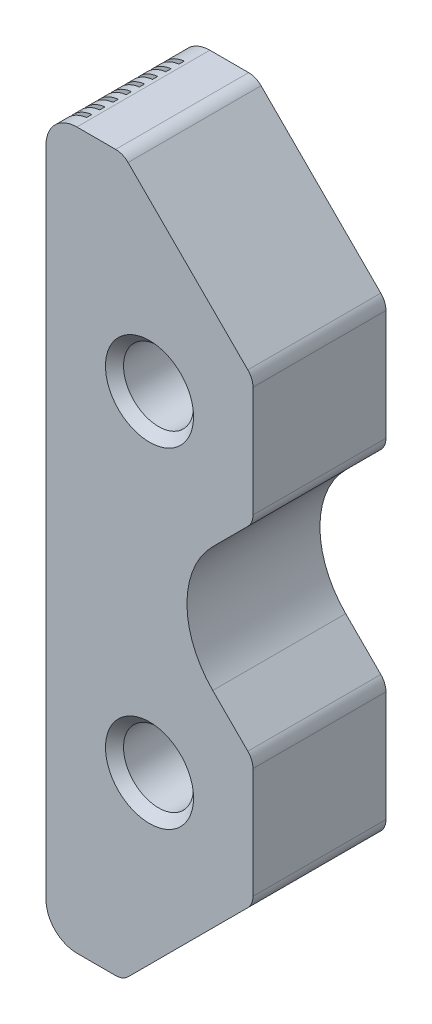
from build123d import *

# Parameters (mm, degrees)
BOSS_EXTRUDE1_DEPTH             = 7.6708
SKETCH2_W                       = 5.08
SKETCH2_H                       = 0.3048
CUT_EXTRUDE1_DEPTH              = 38.1
LPATTERN1_COUNT                 = 8
LPATTERN1_PITCH                 = 0.762
F_10_32_TAPPED_HOLE1_AT_2_COUNT = 2
F_10_32_TAPPED_HOLE1_AT_2_PITCH = 19.05


with BuildPart() as part:
    # Sketch1 → Boss-Extrude1 (new body)
    with BuildSketch(Plane.XY):
        with BuildLine():
            Line((52.1716, 20.6375), (54.409054124, 20.6375))
            ThreePointArc((54.409054124, 20.6375), (54.797860491, 20.560161605), (55.127474613, 20.33992049))
            Line((55.127474613, 20.33992049), (62.03402049, 13.433374613))
            ThreePointArc((62.03402049, 13.433374613), (62.254261605, 13.103760491), (62.3316, 12.714954124))
            Line((62.3316, 12.714954124), (62.3316, 6.335045876))
            ThreePointArc((62.3316, 6.335045876), (62.254261605, 5.946239509), (62.03402049, 5.616625387))
            Line((62.03402049, 5.616625387), (60.009497552, 3.592102448))
            ThreePointArc((60.009497552, 3.592102448), (58.5216, 0), (60.009497552, -3.592102448))
            Line((60.009497552, -3.592102448), (62.03402049, -5.616625387))
            ThreePointArc((62.03402049, -5.616625387), (62.254261605, -5.946239509), (62.3316, -6.335045876))
            Line((62.3316, -6.335045876), (62.3316, -12.714954124))
            ThreePointArc((62.3316, -12.714954124), (62.254261605, -13.103760491), (62.03402049, -13.433374613))
            Line((62.03402049, -13.433374613), (55.127474613, -20.33992049))
            ThreePointArc((55.127474613, -20.33992049), (54.797860491, -20.560161605), (54.409054124, -20.6375))
            Line((54.409054124, -20.6375), (52.1716, -20.6375))
            ThreePointArc((52.1716, -20.6375), (50.914364143, -20.116735857), (50.3936, -18.8595))
            Line((50.3936, -18.8595), (50.3936, 18.8595))
            ThreePointArc((50.3936, 18.8595), (50.914364143, 20.116735857), (52.1716, 20.6375))
        make_face()
    extrude(amount=-BOSS_EXTRUDE1_DEPTH)

    # Sketch2 → Cut-Extrude1 (cut, symmetric)
    with BuildSketch(Plane(origin=(0, 0, 0), x_dir=(1, 0, 0), z_dir=(0, 1, 0))):
        with Locations((49.4284, 0.9144)):
            Rectangle(SKETCH2_W, SKETCH2_H)
    cut_extrude1 = extrude(amount=CUT_EXTRUDE1_DEPTH, both=True, mode=Mode.SUBTRACT)

    # LPattern1: Cut-Extrude1 ×8
    with Locations(*[(0, 0, -i * LPATTERN1_PITCH) for i in range(1, LPATTERN1_COUNT)]):
        add(cut_extrude1, mode=Mode.SUBTRACT)

    # Sketch3 → #10-32 Tapped Hole1 (revolve, cut)
    with BuildSketch(Plane(origin=(56.3626, 9.525, 0), x_dir=(0, -1, 0), z_dir=(1, 0, 0))):
        Polygon((0, 0), (0, 7.6708), (2.54, 7.6708), (2.0193, 7.1501), (2.0193, 0.5207), (2.54, 0), align=None)
    f_10_32_tapped_hole1 = revolve(axis=Axis((56.3626, 9.525, 6.35), (0, 0, -1)), mode=Mode.SUBTRACT)

    # #10-32 Tapped Hole1 at 2: #10-32 Tapped Hole1 ×2
    with Locations(*[(0, -i * F_10_32_TAPPED_HOLE1_AT_2_PITCH, 0) for i in range(1, F_10_32_TAPPED_HOLE1_AT_2_COUNT)]):
        add(f_10_32_tapped_hole1, mode=Mode.SUBTRACT)


solid = part.part
